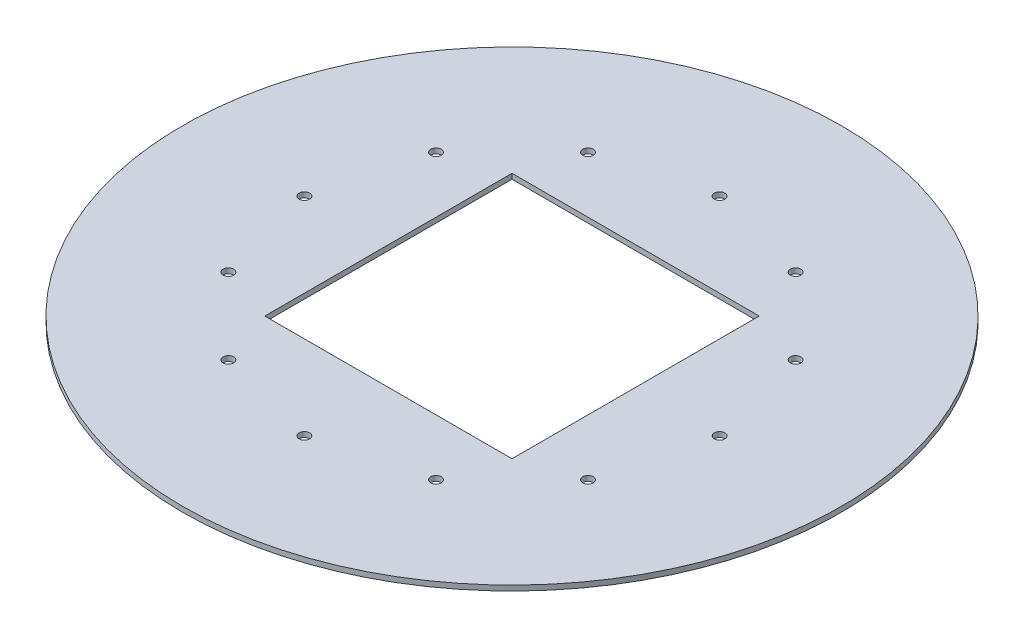
from build123d import *

# Parameters (mm, degrees)
SKETCH1_W           = 40
SKETCH1_H           = 1.57
BOSS_EXTRUDE1_START = -1.57
SKETCH2_R           = 60
SKETCH2_W           = 75
SKETCH2_H           = 75
BOSS_EXTRUDE1_DEPTH = 1.57
SKETCH3_R           = 1.6
CUT_EXTRUDE1_DEPTH  = 142.430070706
CIRPATTERN1_COUNT   = 12


with BuildPart() as part:
    # Sketch1 → Revolve1 (revolve)
    with BuildSketch(Plane.XY, mode=Mode.PRIVATE) as revolve1_sk:
        with Locations((-80, 0)):
            Rectangle(SKETCH1_W, SKETCH1_H)
    revolve(revolve1_sk.sketch.rotate(Axis((0, -200069.047495165, 0), (0, 1, 0)), 270), axis=Axis((0, -200069.047495165, 0), (0, 1, 0)))

    # Sketch2 → Boss-Extrude1 (add)
    with BuildSketch(Plane(origin=(0, 0.785, 0), x_dir=(1, 0, 0), z_dir=(0, 1, 0)).offset(BOSS_EXTRUDE1_START)):
        Circle(SKETCH2_R)
        Rectangle(SKETCH2_W, SKETCH2_H, mode=Mode.SUBTRACT)
    extrude(amount=BOSS_EXTRUDE1_DEPTH)

    # Sketch3 → Cut-Extrude1 (cut, through all)
    with BuildSketch(Plane(origin=(0, 0.785, 0), x_dir=(1, 0, 0), z_dir=(0, 1, 0))):
        with Locations(Location((0, 63, 0), (0, 0, 270))):
            Circle(SKETCH3_R)
    cut_extrude1 = extrude(amount=-CUT_EXTRUDE1_DEPTH, mode=Mode.SUBTRACT)

    # CirPattern1: Cut-Extrude1 ×12 about axis
    cirpattern1_axis = Axis((0, 0, 0), (0, 1, 0))
    for i in range(1, CIRPATTERN1_COUNT):
        add(cut_extrude1.rotate(cirpattern1_axis, i * 360 / CIRPATTERN1_COUNT), mode=Mode.SUBTRACT)


solid = part.part
